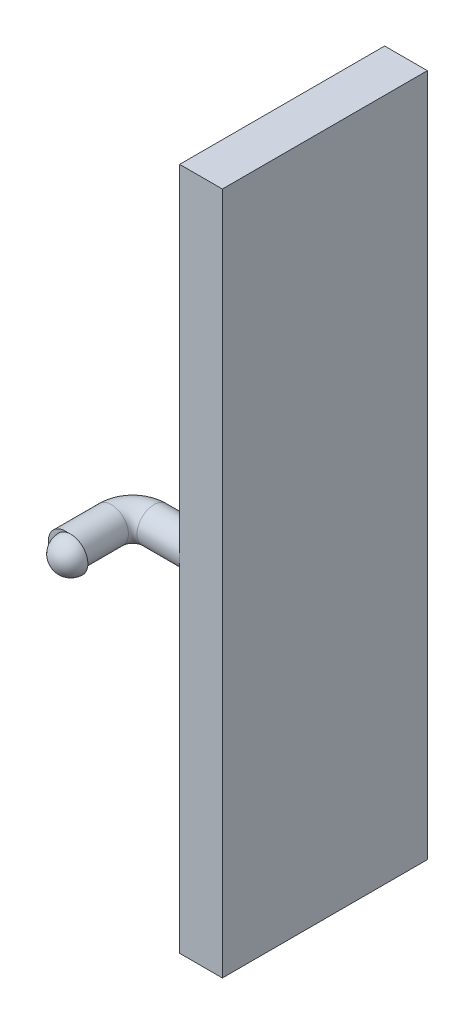
from build123d import *

# Parameters (mm, degrees)
BOSS_EXTRUDE1_DEPTH = 6.35
PEG_BASE_R          = 2.54
BOTTOM_PEG_R        = 3.175
BOSS_EXTRUDE2_DEPTH = 10


with BuildPart() as part:
    # Base → Boss-Extrude1 (new body)
    with BuildSketch(Plane.YZ):
        Polygon((-50.8, 2.54), (50.8, 2.54), (50.8, -2.54), (50.8, -27.94), (-50.8, -27.94), (-50.8, -2.54), align=None)
    extrude(amount=-BOSS_EXTRUDE1_DEPTH)

    # Top Peg: sweep along a path in Sweep 2
    with BuildLine(Plane(origin=(0, 0, 0), x_dir=(-1, 0, 0), z_dir=(0, 1, 0))) as top_peg_path:
        Line((6.35, 0), (12.7, 0))
        ThreePointArc((12.7, 0), (14.94506403, 0.92993597), (15.875, 3.175))
        Line((15.875, 3.175), (15.875, 10))
    # Peg Base → Top Peg (sweep)
    with BuildSketch(Plane.YZ.offset(-6.35)):
        Circle(PEG_BASE_R)
    sweep(path=top_peg_path.line)

    # Bottom Peg → Boss-Extrude2 (add)
    with BuildSketch(Plane.YZ.offset(-6.35)):
        with Locations(Location((0, -25.4, 0), (0, 0, 270))):
            Circle(BOTTOM_PEG_R)
    extrude(amount=-BOSS_EXTRUDE2_DEPTH)

    # Sketch4 → Revolve1 (revolve)
    with BuildSketch(Plane(origin=(0, 0, 0), x_dir=(-1, 0, 0), z_dir=(0, 1, 0))):
        with BuildLine():
            Line((15.08, 12.54), (15.08, 10))
            Line((15.08, 10), (17.62, 10))
            ThreePointArc((17.62, 10), (16.876051224, 11.796051224), (15.08, 12.54))
        make_face()
    revolve(axis=Axis((-15.08, 0, 12.54), (0, 0, -1)))

    # Bottom Ball Head → Revolve2 (revolve)
    with BuildSketch(Plane(origin=(0, 0, 0), x_dir=(-1, 0, 0), z_dir=(0, 1, 0)), mode=Mode.PRIVATE) as revolve2_sk:
        with BuildLine():
            ThreePointArc((19.525, -25.4), (18.59506403, -27.64506403), (16.35, -28.575))
            Line((16.35, -28.575), (16.35, -25.4))
            Line((16.35, -25.4), (19.525, -25.4))
        make_face()
    revolve(revolve2_sk.sketch.rotate(Axis((-16.35, 0, -25.4), (-1, 0, 0)), 180), axis=Axis((-16.35, 0, -25.4), (-1, 0, 0)))


solid = part.part
